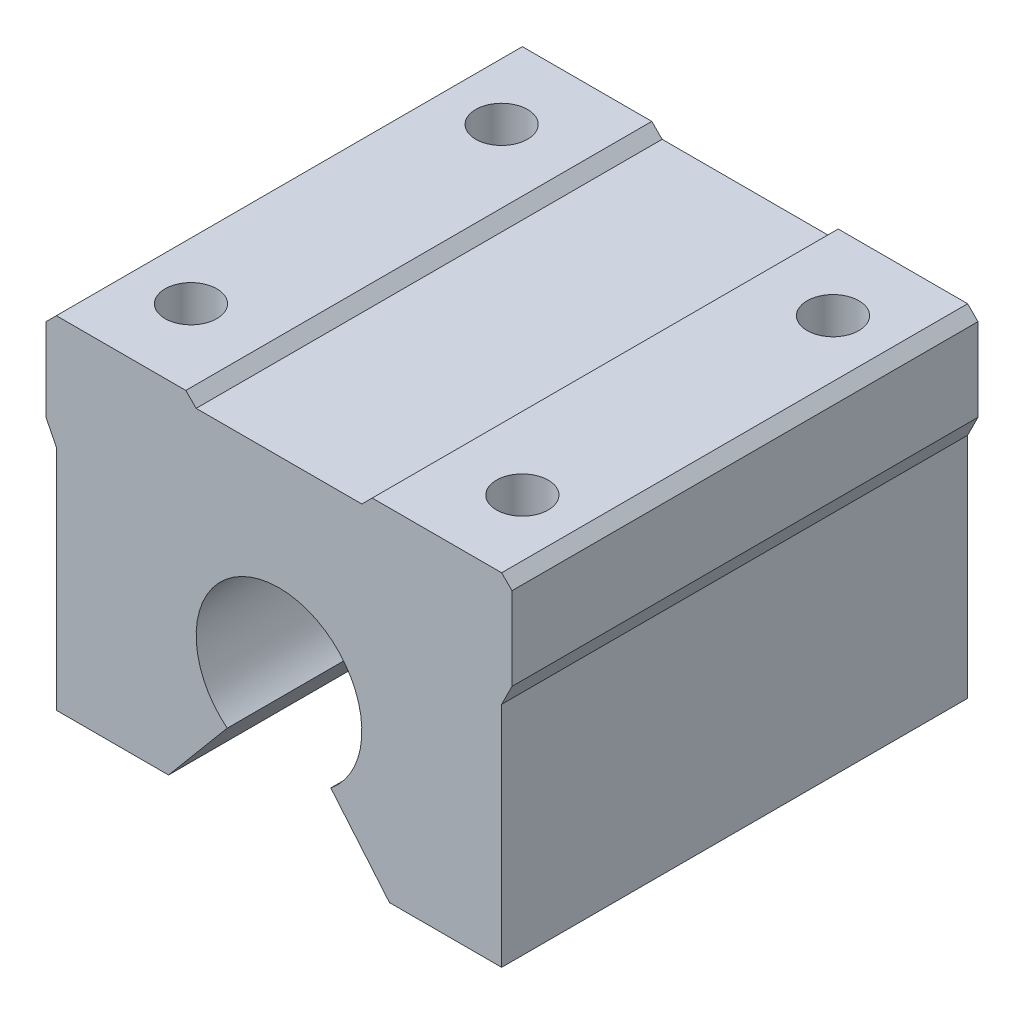
from build123d import *

# Parameters (mm, degrees)
DODANIE_WYCI_GNI_CIE1_DEPTH = 45
SZKIC2_R                    = 2.5
WYTNIJ_WYCI_GNI_CIE1_DEPTH  = 12


with BuildPart() as part:
    # Szkic1 → Dodanie-wyciągnięcie1 (new body)
    with BuildSketch(Plane.XY):
        with BuildLine():
            Line((8, 32), (-8, 32))
            Line((-8, 32), (-9, 33))
            Line((-9, 33), (-21.5, 33))
            Line((-21.5, 33), (-22.5, 32))
            Line((-22.5, 32), (-22.5, 24))
            Line((-22.5, 24), (-21.5, 22))
            Line((-21.5, 22), (-21.5, 0))
            Line((-21.5, 0), (-10.668119688, 0))
            Line((-10.668119688, 0), (-5, 6.755002002))
            ThreePointArc((-5, 6.755002002), (0, 21), (5, 6.755002002))
            Line((5, 6.755002002), (10.668119688, 0))
            Line((10.668119688, 0), (21.5, 0))
            Line((21.5, 0), (21.5, 22))
            Line((21.5, 22), (22.5, 24))
            Line((22.5, 24), (22.5, 32))
            Line((22.5, 32), (21.5, 33))
            Line((21.5, 33), (9, 33))
            Line((9, 33), (8, 32))
        make_face()
    extrude(amount=DODANIE_WYCI_GNI_CIE1_DEPTH)

    # Szkic2 → Wytnij-wyciągnięcie1 (cut)
    with BuildSketch(Plane(origin=(0, 33, 0), x_dir=(1, 0, 0), z_dir=(0, 1, 0))):
        with Locations(Location((-16, -37.5, 0), (0, 0, 270))):
            Circle(SZKIC2_R)
        with Locations(Location((-16, -7.5, 0), (0, 0, 270))):
            Circle(SZKIC2_R)
        with Locations(Location((16, -7.5, 0), (0, 0, 270))):
            Circle(SZKIC2_R)
        with Locations(Location((16, -37.5, 0), (0, 0, 270))):
            Circle(SZKIC2_R)
    extrude(amount=-WYTNIJ_WYCI_GNI_CIE1_DEPTH, mode=Mode.SUBTRACT)

    # Wytnij-wyciągnięcie2 cone 1 section (through the dimple's axis) → Wytnij-wyciągnięcie2 (revolve, cut)
    with BuildSketch(Plane(origin=(16, 21, 7.5), x_dir=(0, 0, 1), z_dir=(1, 0, 0))):
        Polygon((0, 0), (2.5, 0), (0, 1.56217338), align=None)
    revolve(axis=Axis((16, 21, 7.5), (0, -1, 0)), mode=Mode.SUBTRACT)

    # Wytnij-wyciągnięcie2 cone 2 section (through the dimple's axis) → Wytnij-wyciągnięcie2 cone 2 (revolve, cut)
    with BuildSketch(Plane(origin=(-16, 21, 7.5), x_dir=(0, 0, 1), z_dir=(1, 0, 0))):
        Polygon((0, 0), (2.5, 0), (0, 1.56217338), align=None)
    revolve(axis=Axis((-16, 21, 7.5), (0, -1, 0)), mode=Mode.SUBTRACT)

    # Wytnij-wyciągnięcie2 cone 3 section (through the dimple's axis) → Wytnij-wyciągnięcie2 cone 3 (revolve, cut)
    with BuildSketch(Plane(origin=(-16, 21, 37.5), x_dir=(0, 0, 1), z_dir=(1, 0, 0))):
        Polygon((0, 0), (2.5, 0), (0, 1.56217338), align=None)
    revolve(axis=Axis((-16, 21, 37.5), (0, -1, 0)), mode=Mode.SUBTRACT)

    # Wytnij-wyciągnięcie2 cone 4 section (through the dimple's axis) → Wytnij-wyciągnięcie2 cone 4 (revolve, cut)
    with BuildSketch(Plane(origin=(16, 21, 37.5), x_dir=(0, 0, 1), z_dir=(1, 0, 0))):
        Polygon((0, 0), (2.5, 0), (0, 1.56217338), align=None)
    revolve(axis=Axis((16, 21, 37.5), (0, -1, 0)), mode=Mode.SUBTRACT)


solid = part.part
